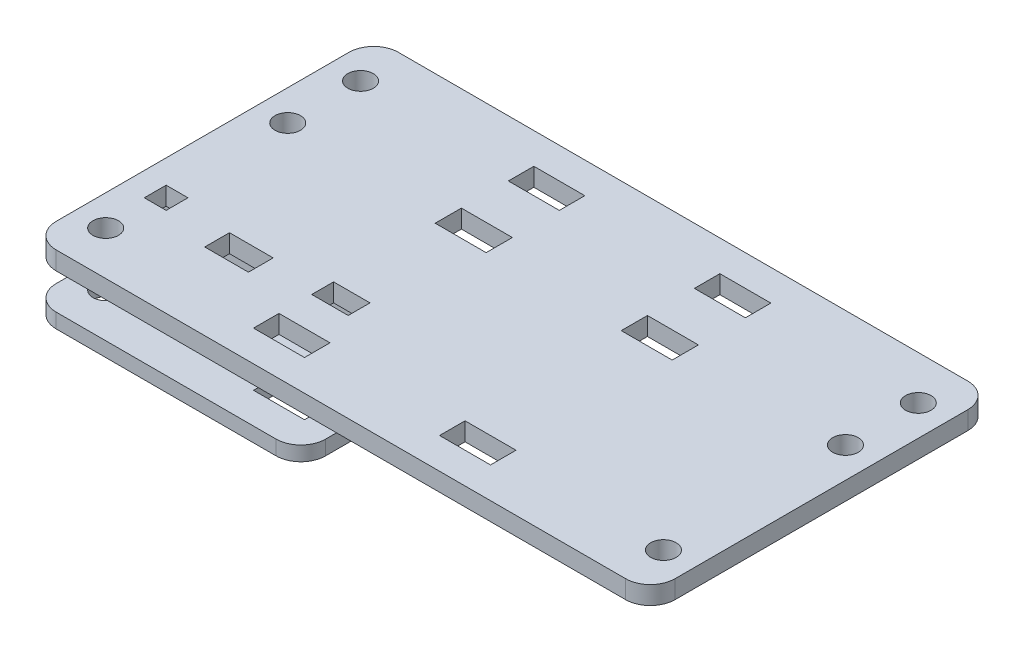
from build123d import *

# Parameters (mm, degrees)
SKETCH_1_W          = 85
SKETCH_1_H          = 47
SKETCH_1_R          = 1.75
SKETCH_1_W_2        = 7
SKETCH_1_H_2        = 3.5
SKETCH_1_H_3        = 3.6
EXTRUDE_1_DEPTH     = 2.5
SKETCH_2_W          = 37
SKETCH_2_H          = 3
EXTRUDE_2_DEPTH     = 4.9
EXTRUDE_START       = 2
SKETCH_3_W          = 37
SKETCH_3_H          = 20.75
SKETCH_3_R          = 1.75
SKETCH_3_W_2        = 7
SKETCH_3_H_2        = 3.5
EXTRUDE_4_DEPTH     = 2
FILLET_1_R          = 3.4
SKETCH_4_W          = 6
SKETCH_4_H          = 3.4
SKETCH_4_W_2        = 5
SKETCH_4_H_2        = 3
SKETCH_4_W_3        = 3
CUT_EXTRUDE_1_DEPTH = 7.4
FILLET_2_R          = 6


with BuildPart() as part:
    # 草图1 → 凸台-拉伸1 (new body)
    with BuildSketch(Plane(origin=(0, 0, 0), x_dir=(1, 0, 0), z_dir=(0, 1, 0))):
        Rectangle(SKETCH_1_W, SKETCH_1_H)
        with Locations(Location((-38.3, -17.5, 0), (0, 0, 270))):
            Circle(SKETCH_1_R, mode=Mode.SUBTRACT)
        with Locations(Location((38.3, -17.5, 0), (0, 0, 270))):
            Circle(SKETCH_1_R, mode=Mode.SUBTRACT)
        with Locations(Location((-38.3, 7.5, 0), (0, 0, 270))):
            Circle(SKETCH_1_R, mode=Mode.SUBTRACT)
        with Locations(Location((38.3, 7.5, 0), (0, 0, 270))):
            Circle(SKETCH_1_R, mode=Mode.SUBTRACT)
        with Locations(Location((-38.3, 17.5, 0), (0, 0, 270))):
            Circle(SKETCH_1_R, mode=Mode.SUBTRACT)
        with Locations(Location((38.3, 17.5, 0), (0, 0, 270))):
            Circle(SKETCH_1_R, mode=Mode.SUBTRACT)
        with Locations((-12.75, -17.5)):
            Rectangle(SKETCH_1_W_2, SKETCH_1_H_2, mode=Mode.SUBTRACT)
        with Locations((12.8, -17.5)):
            Rectangle(SKETCH_1_W_2, SKETCH_1_H_2, mode=Mode.SUBTRACT)
        with Locations((-12.75, 7.5)):
            Rectangle(SKETCH_1_W_2, SKETCH_1_H_3, mode=Mode.SUBTRACT)
        with Locations((12.8, 7.5)):
            Rectangle(SKETCH_1_W_2, SKETCH_1_H_3, mode=Mode.SUBTRACT)
        with Locations((-12.75, 17.5)):
            Rectangle(SKETCH_1_W_2, SKETCH_1_H_2, mode=Mode.SUBTRACT)
        with Locations((12.8, 17.5)):
            Rectangle(SKETCH_1_W_2, SKETCH_1_H_2, mode=Mode.SUBTRACT)
    extrude(amount=EXTRUDE_1_DEPTH)

    # 草图2 → 凸台-拉伸2 (add)
    with BuildSketch(Plane(origin=(0, 0, 0), x_dir=(1, 0, 0), z_dir=(0, 1, 0))):
        with Locations((-24, -4.25)):
            Rectangle(SKETCH_2_W, SKETCH_2_H)
    extrude(amount=-EXTRUDE_2_DEPTH)

    # 草图3 → 凸台-拉伸4 (add)
    with BuildSketch(Plane(origin=(0, -4.9, 0), x_dir=(-1, 0, 0), z_dir=(0, -1, 0)).offset(EXTRUDE_START)):
        with Locations((24, -13.125)):
            Rectangle(SKETCH_3_W, SKETCH_3_H)
        with Locations(Location((38.3, -17.5, 0), (0, 0, 270))):
            Circle(SKETCH_3_R, mode=Mode.SUBTRACT)
        with Locations((12.75, -17.5)):
            Rectangle(SKETCH_3_W_2, SKETCH_3_H_2, mode=Mode.SUBTRACT)
    extrude(amount=-EXTRUDE_4_DEPTH)

    # 圆角1
    fillet_1_edges = [part.edges().sort_by_distance(p)[0] for p in [
        (-5.5, -5.9, 23.5),
        (-42.5, -5.9, 23.5),
        (42.5, 1.25, 23.5),
        (-42.5, 1.25, 23.5),
        (-42.5, 1.25, -23.5),
        (42.5, 1.25, -23.5),
    ]]
    fillet(fillet_1_edges, radius=FILLET_1_R)

    # 草图4 → 切除-拉伸1 (cut)
    with BuildSketch(Plane(origin=(0, -4.9, 0), x_dir=(-1, 0, 0), z_dir=(0, -1, 0))):
        with Locations((26.25, -11.25)):
            Rectangle(SKETCH_4_W, SKETCH_4_H)
        with Locations((13.75, -9.75)):
            Rectangle(SKETCH_4_W_2, SKETCH_4_H_2)
        with Locations((37.75, -9.75)):
            Rectangle(SKETCH_4_W_3, SKETCH_4_H_2)
    extrude(amount=-CUT_EXTRUDE_1_DEPTH, mode=Mode.SUBTRACT)

    # 圆角2
    fillet_2_edges = [part.edges().sort_by_distance(p)[0] for p in [
        (-24, 0, 2.75),
    ]]
    fillet(fillet_2_edges, radius=FILLET_2_R)


solid = part.part
